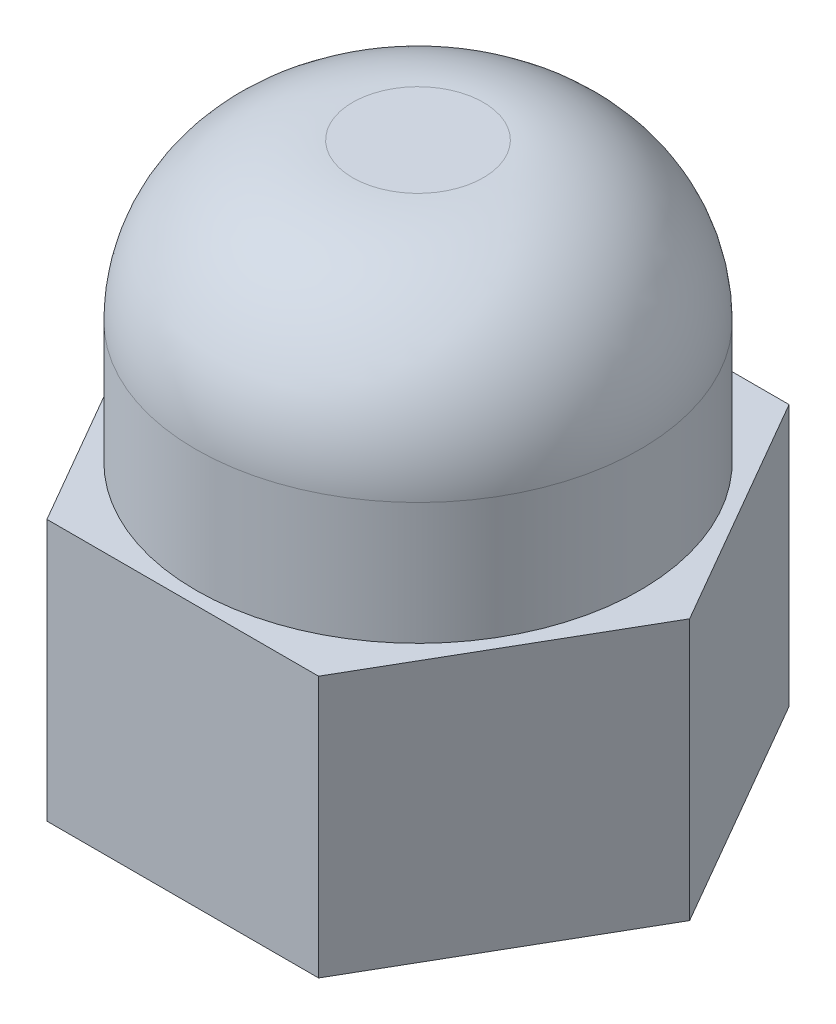
from build123d import *

# Parameters (mm, degrees)
BOSS_EXTRU_1_DEPTH   = 3
ESQUISSE2_R          = 2.55
BOSS_EXTRU_2_DEPTH   = 3.2
CONG_1_R             = 1.8
D_GAGEMENT_M31_D     = 3.4
D_GAGEMENT_M31_DEPTH = 5
D_GAGEMENT_M31_TIP   = 1.021463052


with BuildPart() as part:
    # Esquisse1 → Boss.-Extru.1 (new body)
    with BuildSketch(Plane(origin=(0, 0, 0), x_dir=(1, 0, 0), z_dir=(0, 1, 0))):
        Polygon((3.117691454, 0), (1.558845727, 2.7), (-1.558845727, 2.7), (-3.117691454, 0), (-1.558845727, -2.7), (1.558845727, -2.7), align=None)
    extrude(amount=BOSS_EXTRU_1_DEPTH)

    # Esquisse2 → Boss.-Extru.2 (add)
    with BuildSketch(Plane(origin=(0, 3, 0), x_dir=(1, 0, 0), z_dir=(0, 1, 0))):
        with Locations(Location((0, 0, 0), (0, 0, 270))):
            Circle(ESQUISSE2_R)
    extrude(amount=BOSS_EXTRU_2_DEPTH)

    # Congé1
    cong_1_edges = [part.edges().sort_by_distance(p)[0] for p in [
        (0, 6.2, -2.55),
    ]]
    fillet(cong_1_edges, radius=CONG_1_R)

    # Dégagement M31
    with Locations(Plane(origin=(0, 0, 0), x_dir=(-1, 0, 0), z_dir=(0, -1, 0))):
        with Locations((0, 0)):
            Hole(D_GAGEMENT_M31_D / 2, depth=D_GAGEMENT_M31_DEPTH)
            with Locations((0, 0, -(D_GAGEMENT_M31_DEPTH + D_GAGEMENT_M31_TIP / 2))):  # 118° drill point
                Cone(0, D_GAGEMENT_M31_D / 2, D_GAGEMENT_M31_TIP, mode=Mode.SUBTRACT)


solid = part.part
